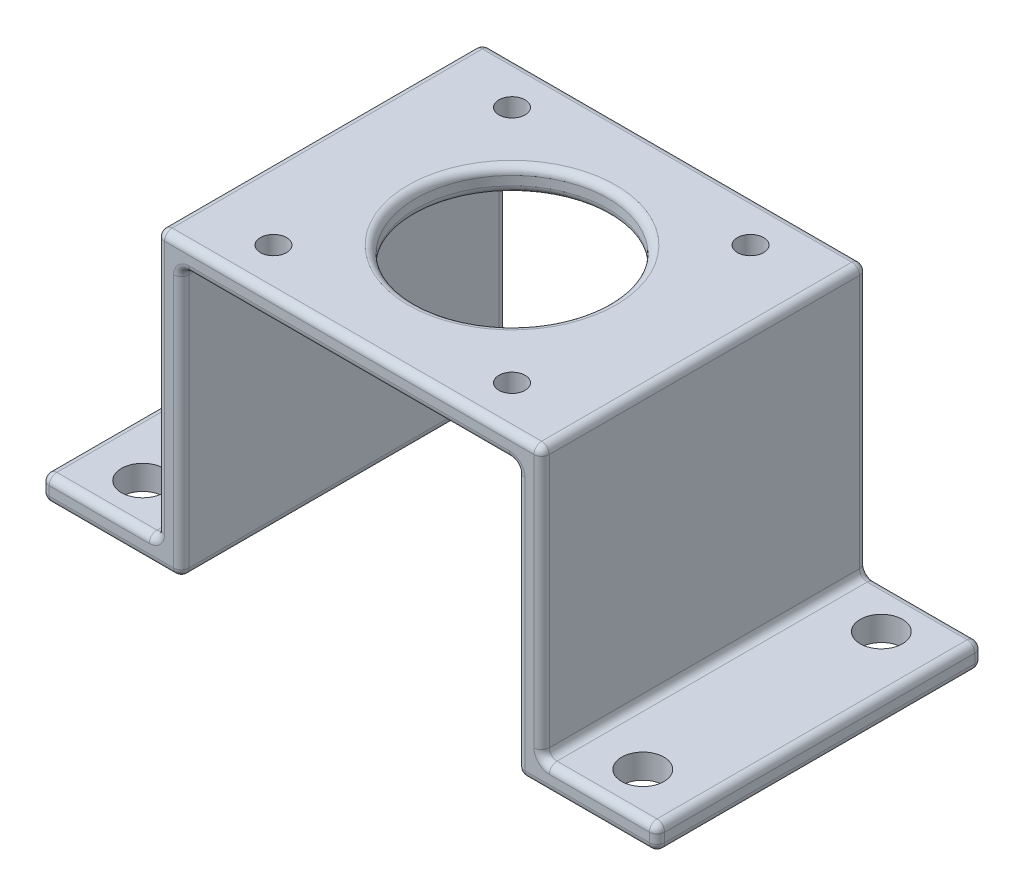
from build123d import *

# Parameters (mm, degrees)
SKETCH1_W           = 50
SKETCH1_H           = 42.3
SKETCH1_R           = 12.5
SKETCH1_R_2         = 1.7
BOSS_EXTRUDE1_DEPTH = 3.175
SKETCH2_W           = 3.175
SKETCH2_H           = 42.3
BOSS_EXTRUDE2_DEPTH = 35
SKETCH3_W           = 15
SKETCH3_H           = 42.3
SKETCH3_R           = 2.75
BOSS_EXTRUDE3_DEPTH = 3.175
FILLET1_R           = 1
FILLET2_R           = 1


with BuildPart() as part:
    # Sketch1 → Boss-Extrude1 (new body)
    with BuildSketch(Plane(origin=(0, 0, 0), x_dir=(1, 0, 0), z_dir=(0, 1, 0))):
        Rectangle(SKETCH1_W, SKETCH1_H)
        with Locations(Location((0, 0, 0), (0, 0, 270))):
            Circle(SKETCH1_R, mode=Mode.SUBTRACT)
        with Locations(Location((-15.5, 15.5, 0), (0, 0, 270))):
            Circle(SKETCH1_R_2, mode=Mode.SUBTRACT)
        with Locations(Location((15.5, 15.5, 0), (0, 0, 270))):
            Circle(SKETCH1_R_2, mode=Mode.SUBTRACT)
        with Locations(Location((15.5, -15.5, 0), (0, 0, 270))):
            Circle(SKETCH1_R_2, mode=Mode.SUBTRACT)
        with Locations(Location((-15.5, -15.5, 0), (0, 0, 270))):
            Circle(SKETCH1_R_2, mode=Mode.SUBTRACT)
    extrude(amount=BOSS_EXTRUDE1_DEPTH)

    # Sketch2 → Boss-Extrude2 (add)
    with BuildSketch(Plane.XZ):
        with Locations((-23.4125, 0)):
            Rectangle(SKETCH2_W, SKETCH2_H)
        with Locations((23.4125, 0)):
            Rectangle(SKETCH2_W, SKETCH2_H)
    extrude(amount=BOSS_EXTRUDE2_DEPTH)

    # Sketch3 → Boss-Extrude3 (add)
    # profile 1 of 2: a face of its own
    with BuildSketch(Plane.XZ.offset(35)):
        with Locations((-32.5, 0)):
            Rectangle(SKETCH3_W, SKETCH3_H)
        with Locations(Location((-32.5, 15.5, 0), (0, 0, 270))):
            Circle(SKETCH3_R, mode=Mode.SUBTRACT)
        with Locations(Location((-32.5, -15.5, 0), (0, 0, 270))):
            Circle(SKETCH3_R, mode=Mode.SUBTRACT)
    # profile 2 of 2: a face of its own
    with BuildSketch(Plane.XZ.offset(35)):
        with Locations((32.5, 0)):
            Rectangle(SKETCH3_W, SKETCH3_H)
        with Locations(Location((32.5, -15.5, 0), (0, 0, 270))):
            Circle(SKETCH3_R, mode=Mode.SUBTRACT)
        with Locations(Location((32.5, 15.5, 0), (0, 0, 270))):
            Circle(SKETCH3_R, mode=Mode.SUBTRACT)
    extrude(amount=-BOSS_EXTRUDE3_DEPTH)

    # Fillet1
    fillet1_edges = [part.edges().sort_by_distance(p)[0] for p in [
        (25, 3.175, 0),
        (0, 3.175, -21.15),
        (0, 0, 21.15),
        (-21.825, 0, 0),
        (-21.825, -17.5, -21.15),
        (-21.825, -17.5, 21.15),
        (-30.9125, -35, -21.15),
        (-21.825, -35, 0),
        (-30.9125, -35, 21.15),
        (0, 0, -21.15),
        (21.825, 0, 0),
        (21.825, -17.5, 21.15),
        (21.825, -17.5, -21.15),
        (-25, 3.175, 0),
        (30.9125, -35, 21.15),
        (21.825, -35, 0),
        (30.9125, -35, -21.15),
        (-25, -31.825, 0),
        (-32.5, -31.825, -21.15),
        (-40, -31.825, 0),
        (-40, -33.4125, -21.15),
        (-32.5, -31.825, 21.15),
        (-40, -33.4125, 21.15),
        (-40, -35, 0),
        (25, -31.825, 0),
        (32.5, -31.825, 21.15),
        (40, -31.825, 0),
        (40, -33.4125, 21.15),
        (32.5, -31.825, -21.15),
        (40, -33.4125, -21.15),
        (-25, -14.325, -21.15),
        (40, -35, 0),
        (25, -14.325, -21.15),
        (25, -14.325, 21.15),
        (-25, -14.325, 21.15),
        (0, 3.175, 21.15),
    ]]
    fillet(fillet1_edges, radius=FILLET1_R)

    # Fillet2
    fillet2_edges = [part.edges().sort_by_distance(p)[0] for p in [
        (0, 0, -12.5),
        (0, 3.175, -12.5),
    ]]
    fillet(fillet2_edges, radius=FILLET2_R)


solid = part.part
